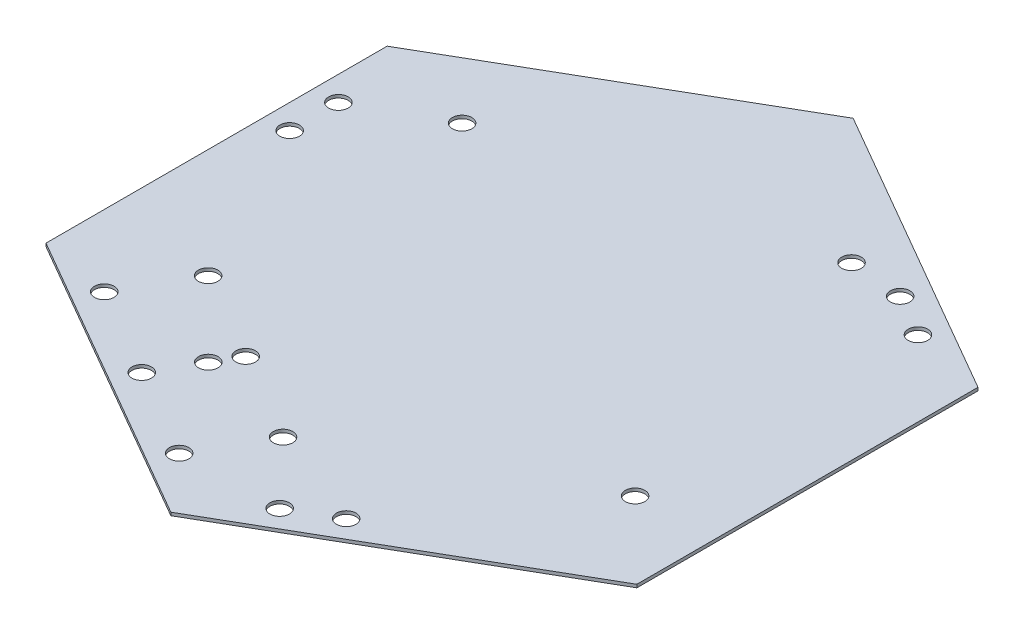
from build123d import *

# Parameters (mm, degrees)
SKETCH1_R           = 2.54
BOSS_EXTRUDE1_DEPTH = 0.8128
SKETCH2_R           = 2.54
CUT_EXTRUDE1_DEPTH  = 118.606454516
SKETCH3_R           = 2.54
CUT_EXTRUDE2_DEPTH  = 118.606454516
SKETCH5_R           = 2.54
CUT_EXTRUDE3_DEPTH  = 2.54


with BuildPart() as part:
    # Sketch1 → Boss-Extrude1 (new body)
    with BuildSketch(Plane(origin=(0, 0, 0), x_dir=(1, 0, 0), z_dir=(0, 1, 0))):
        Polygon((0, 88.9), (-76.989658396, 44.45), (-76.989658396, -44.45), (0, -88.9), (76.989658396, -44.45), (76.989658396, 44.45), align=None)
        with Locations(Location((13.322783942, -73.875738686, 0), (0, 0, 270))):
            Circle(SKETCH1_R, mode=Mode.SUBTRACT)
        with Locations(Location((24.32130657, -67.525738686, 0), (0, 0, 270))):
            Circle(SKETCH1_R, mode=Mode.SUBTRACT)
        with Locations(Location((-70.639658396, 12.7, 0), (0, 0, 270))):
            Circle(SKETCH1_R, mode=Mode.SUBTRACT)
        with Locations(Location((-70.639658396, 25.4, 0), (0, 0, 270))):
            Circle(SKETCH1_R, mode=Mode.SUBTRACT)
        with Locations(Location((46.318351826, 54.825738686, 0), (0, 0, 270))):
            Circle(SKETCH1_R, mode=Mode.SUBTRACT)
        with Locations(Location((57.316874454, 48.475738686, 0), (0, 0, 270))):
            Circle(SKETCH1_R, mode=Mode.SUBTRACT)
    extrude(amount=BOSS_EXTRUDE1_DEPTH)

    # Sketch2 → Cut-Extrude1 (cut, through all)
    with BuildSketch(Plane(origin=(0, 0.8128, 0), x_dir=(1, 0, 0), z_dir=(0, 1, 0))):
        with Locations(Location((-49.850334746, 36.846687445, 0), (0, 0, 270))):
            Circle(SKETCH2_R)
        with Locations(Location((-25.4, -43.994090512, 0), (0, 0, 270))):
            Circle(SKETCH2_R)
        with Locations(Location((32.385, 56.092465403, 0), (0, 0, 270))):
            Circle(SKETCH2_R)
        with Locations(Location((56.835334746, -24.748312555, 0), (0, 0, 270))):
            Circle(SKETCH2_R)
    extrude(amount=-CUT_EXTRUDE1_DEPTH, mode=Mode.SUBTRACT)

    # Sketch3 → Cut-Extrude2 (cut, through all)
    with BuildSketch(Plane(origin=(0, 0.8128, 0), x_dir=(1, 0, 0), z_dir=(0, 1, 0))):
        with Locations(Location((-35.319829198, -61.175738686, 0), (0, 0, 270))):
            Circle(SKETCH3_R)
        with Locations(Location((-28.969829198, -50.177216058, 0), (0, 0, 270))):
            Circle(SKETCH3_R)
    extrude(amount=-CUT_EXTRUDE2_DEPTH, mode=Mode.SUBTRACT)

    # Sketch5 → Cut-Extrude3 (cut)
    with BuildSketch(Plane(origin=(0, 0.8128, 0), x_dir=(1, 0, 0), z_dir=(0, 1, 0))):
        with Locations(Location((-2.3169441, -57.353036215, 0), (0, 0, 270))):
            Circle(SKETCH5_R)
        with Locations(Location((-12.222931679, -74.510738686, 0), (0, 0, 270))):
            Circle(SKETCH5_R)
        with Locations(Location((-58.416726717, -47.840738686, 0), (0, 0, 270))):
            Circle(SKETCH5_R)
        with Locations(Location((-48.510714297, -30.683050557, 0), (0, 0, 270))):
            Circle(SKETCH5_R)
    extrude(amount=-CUT_EXTRUDE3_DEPTH, mode=Mode.SUBTRACT)


solid = part.part
